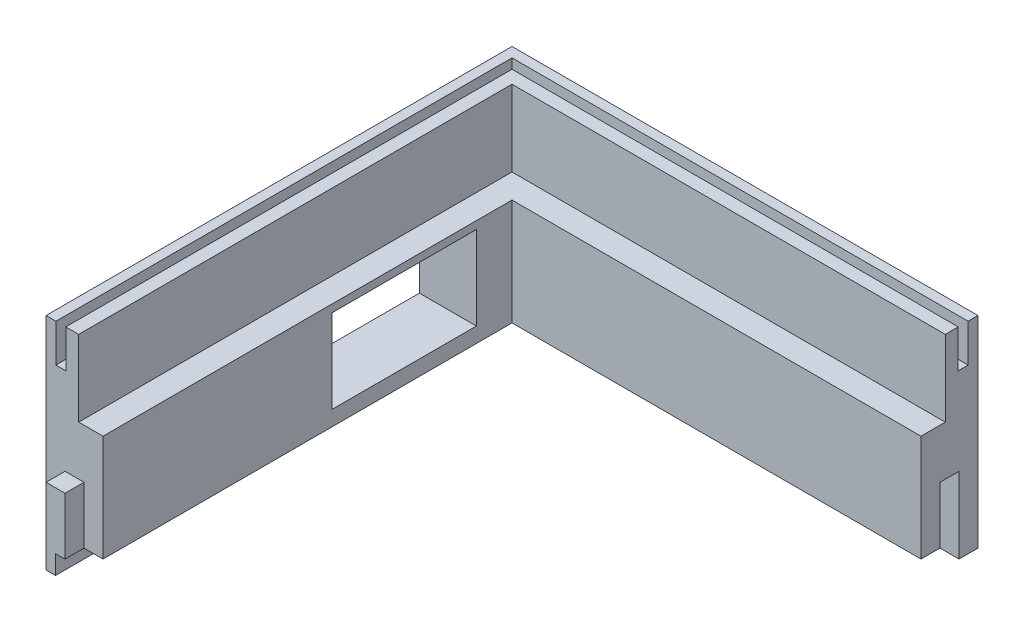
from build123d import *

# Parameters (mm, degrees)
BOSS_EXTRUDE5_DEPTH     = 67.31
CUT_EXTRUDE2_DEPTH      = 12.693340834
CUT_EXTRUDE3_DEPTH      = 25.4
SKETCH11_W              = 6.35
SKETCH11_H              = 25.4
BOSS_EXTRUDE6_DEPTH     = 6.35
SKETCH12_W              = 6.35
SKETCH12_H              = 25.4
CUT_EXTRUDE4_DEPTH      = 6.35
CUT_EXTRUDE5_DEPTH      = 171.430214526
CUT_EXTRUDE5_DEPTH_BACK = 6.35
SKETCH15_W              = 48.26
SKETCH15_H              = 27.94
CUT_EXTRUDE6_DEPTH      = 45.212


with BuildPart() as part:
    # Sketch1 → Boss-Extrude5 (new body)
    with BuildSketch(Plane(origin=(0, 0, 0), x_dir=(1, 0, 0), z_dir=(0, 1, 0))):
        Polygon((-60.605605599, 37.663504972), (95.096394401, 37.663504972), (95.096394401, 18.613504972), (-41.555605599, 18.613504972), (-41.555605599, -118.038495028), (-60.605605599, -118.038495028), align=None)
    extrude(amount=BOSS_EXTRUDE5_DEPTH)

    # Sketch8 → Cut-Extrude2 (cut)
    with BuildSketch(Plane(origin=(0, 67.31, 0), x_dir=(1, 0, 0), z_dir=(0, 1, 0))):
        Polygon((-57.303605599, -118.038495028), (-57.303605599, 34.361504972), (95.096394401, 34.361504972), (95.096394401, 31.059504972), (-54.001605599, 31.059504972), (-54.001605599, -118.038495028), align=None)
    extrude(amount=-CUT_EXTRUDE2_DEPTH, mode=Mode.SUBTRACT)

    # Sketch9 → Cut-Extrude3 (cut)
    with BuildSketch(Plane(origin=(0, 67.31, 0), x_dir=(1, 0, 0), z_dir=(0, 1, 0))):
        Polygon((-49.683605599, -118.038495028), (-49.683605599, 26.741504972), (95.096394401, 26.741504972), (95.096394401, 18.613504972), (-41.555605599, 18.613504972), (-41.555605599, -118.038495028), align=None)
    extrude(amount=-CUT_EXTRUDE3_DEPTH, mode=Mode.SUBTRACT)

    # Sketch11 → Boss-Extrude6 (add)
    with BuildSketch(Plane.XY.offset(118.038495028)):
        with Locations((-51.080605599, 12.7)):
            Rectangle(SKETCH11_W, SKETCH11_H)
    extrude(amount=BOSS_EXTRUDE6_DEPTH)

    # Sketch12 → Cut-Extrude4 (cut)
    with BuildSketch(Plane(origin=(95.096394401, 0, 0), x_dir=(0, 0, -1), z_dir=(1, 0, 0))):
        with Locations((28.138504972, 12.7)):
            Rectangle(SKETCH12_W, SKETCH12_H)
    extrude(amount=-CUT_EXTRUDE4_DEPTH, mode=Mode.SUBTRACT)

    # Sketch13 → Cut-Extrude5 (cut, two sides: drawn at the far end of the back side and taken through both)
    with BuildSketch(Plane.XZ.offset(-CUT_EXTRUDE5_DEPTH_BACK)):
        Polygon((-51.080605599, 570.867892173), (-51.080605599, 124.388495028), (-51.080605599, -25.399651713), (-51.080605599, -28.138504972), (88.746394401, -28.138504972), (535.225791546, -28.138504972), (1173.371683532, 596.477560176), (587.065286387, 1195.483957321), align=None)
    extrude(amount=CUT_EXTRUDE5_DEPTH + CUT_EXTRUDE5_DEPTH_BACK, mode=Mode.SUBTRACT)

    # Sketch15 → Cut-Extrude6 (cut)
    with BuildSketch(Plane(origin=(-41.555605599, 0, 0), x_dir=(0, 0, -1), z_dir=(1, 0, 0))):
        with Locations((-17.412502411, 25.379779706)):
            Rectangle(SKETCH15_W, SKETCH15_H)
    extrude(amount=-CUT_EXTRUDE6_DEPTH, mode=Mode.SUBTRACT)


solid = part.part
